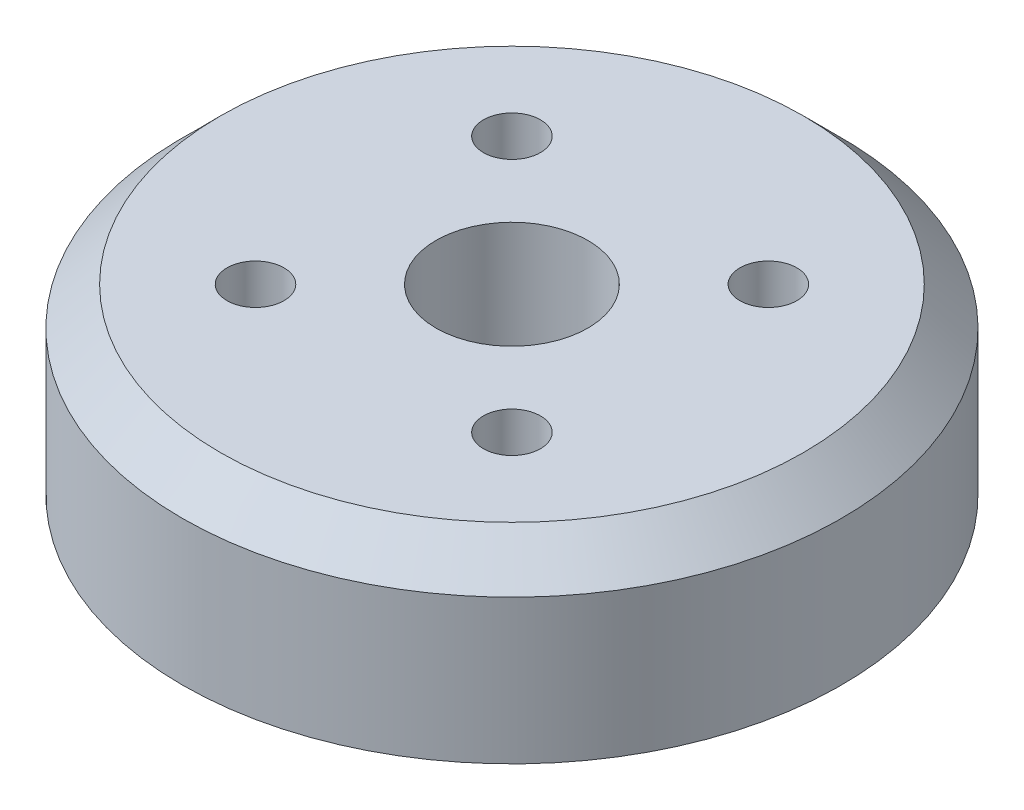
from build123d import *

# Parameters (mm, degrees)
SKETCH_1_R          = 17.35
EXTRUDE_1_DEPTH     = 9.6
CHAMFER_1_SIZE      = 2
SKETCH_2_R          = 4
SKETCH_2_R_2        = 1.5
CUT_EXTRUDE_1_DEPTH = 9.6


with BuildPart() as part:
    # 草图1 → 凸台-拉伸1 (new body)
    with BuildSketch(Plane(origin=(0, 0, 0), x_dir=(1, 0, 0), z_dir=(0, 1, 0))):
        with Locations(Location((0, 0, 0), (0, 0, 270))):
            Circle(SKETCH_1_R)
    extrude(amount=EXTRUDE_1_DEPTH)

    # 倒角1
    chamfer_1_edges = [part.edges().sort_by_distance(p)[0] for p in [
        (0, 9.6, -17.35),
    ]]
    chamfer(chamfer_1_edges, length=CHAMFER_1_SIZE)

    # 草图2 → 切除-拉伸1 (cut)
    with BuildSketch(Plane(origin=(0, 9.6, 0), x_dir=(1, 0, 0), z_dir=(0, 1, 0))):
        with Locations(Location((0, 0, 0), (0, 0, 270))):
            Circle(SKETCH_2_R)
        with Locations(Location((-6.75, 6.75, 0), (0, 0, 270))):
            Circle(SKETCH_2_R_2)
        with Locations(Location((6.75, 6.75, 0), (0, 0, 270))):
            Circle(SKETCH_2_R_2)
        with Locations(Location((6.75, -6.75, 0), (0, 0, 270))):
            Circle(SKETCH_2_R_2)
        with Locations(Location((-6.75, -6.75, 0), (0, 0, 270))):
            Circle(SKETCH_2_R_2)
    extrude(amount=-CUT_EXTRUDE_1_DEPTH, mode=Mode.SUBTRACT)


solid = part.part
